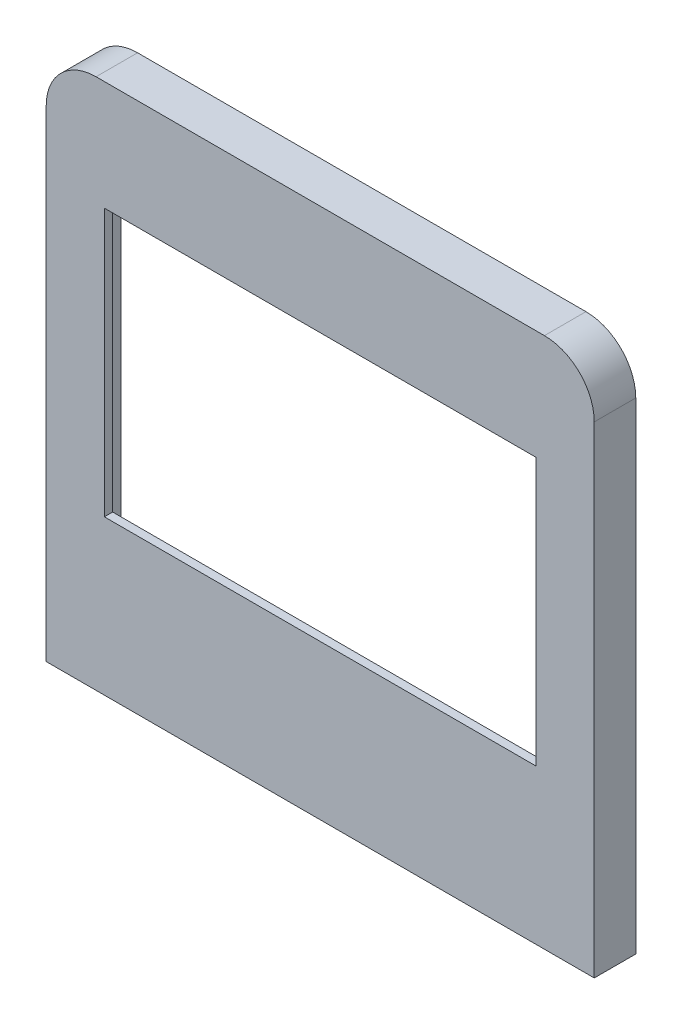
from build123d import *

# Parameters (mm, degrees)
SKETCH_1_W      = 33
SKETCH_1_H      = 32
SKETCH_1_W_2    = 26
SKETCH_1_H_2    = 16.1
EXTRUDE_1_DEPTH = 0.5
SKETCH_2_W      = 33
SKETCH_2_H      = 32
SKETCH_2_W_2    = 29
SKETCH_2_H_2    = 28
EXTRUDE_2_DEPTH = 2
FILLET_1_R      = 3
FILLET_2_R      = 3


with BuildPart() as part:
    # 草图1 → 凸台-拉伸1 (new body)
    with BuildSketch(Plane.XY):
        with Locations((0.334983498, -2.562706271)):
            Rectangle(SKETCH_1_W, SKETCH_1_H)
        with Locations((0.334983498, -1.212706271)):
            Rectangle(SKETCH_1_W_2, SKETCH_1_H_2, mode=Mode.SUBTRACT)
    extrude(amount=EXTRUDE_1_DEPTH)

    # 草图2 → 凸台-拉伸2 (add)
    with BuildSketch(Plane(origin=(0, 0, 0), x_dir=(-1, 0, 0), z_dir=(0, 0, -1))):
        with Locations((-0.334983498, -2.562706271)):
            Rectangle(SKETCH_2_W, SKETCH_2_H)
        with Locations((-0.334983498, -2.562706271)):
            Rectangle(SKETCH_2_W_2, SKETCH_2_H_2, mode=Mode.SUBTRACT)
    extrude(amount=EXTRUDE_2_DEPTH)

    # 圆角1
    fillet_1_edges = [part.edges().sort_by_distance(p)[0] for p in [
        (16.834983498, 13.437293729, -0.75),
    ]]
    fillet(fillet_1_edges, radius=FILLET_1_R)

    # 圆角2
    fillet_2_edges = [part.edges().sort_by_distance(p)[0] for p in [
        (-16.165016502, 13.437293729, -0.75),
    ]]
    fillet(fillet_2_edges, radius=FILLET_2_R)


solid = part.part
